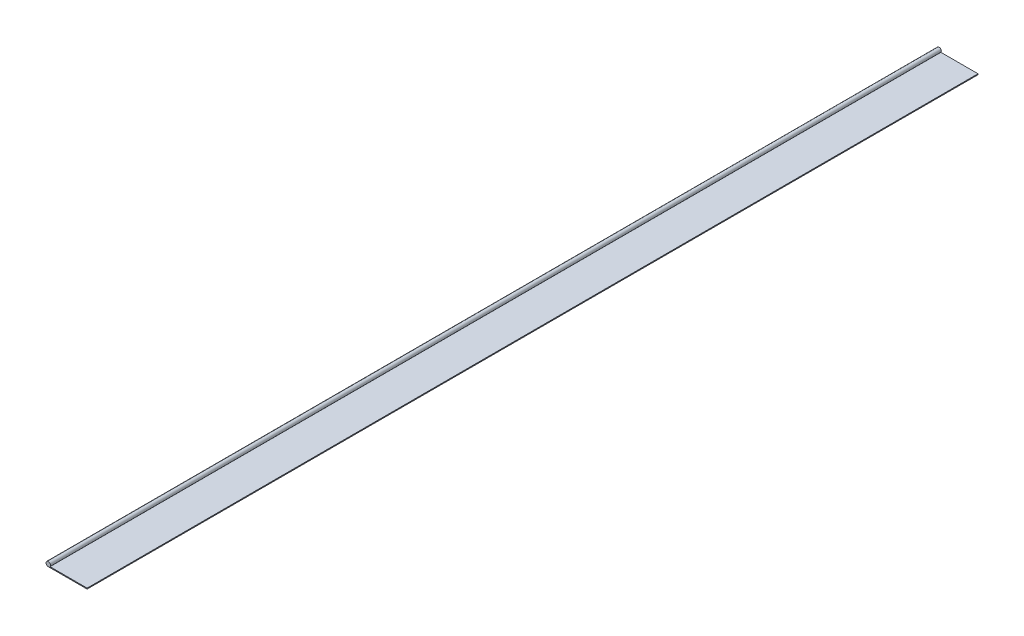
from build123d import *

# Parameters (mm, degrees)
BOSS_EXTRUDE1_DEPTH = 600


with BuildPart() as part:
    # Sketch1 → Boss-Extrude1 (new body)
    with BuildSketch(Plane.XY):
        with BuildLine():
            Line((26.2, -0.9), (1.2, -0.9))
            ThreePointArc((1.2, -0.9), (-0.670820393, 1.341640786), (0, -1.5))
            Line((0, -1.5), (26.2, -1.5))
            Line((26.2, -1.5), (26.2, -0.9))
        make_face()
    extrude(amount=BOSS_EXTRUDE1_DEPTH)


solid = part.part
